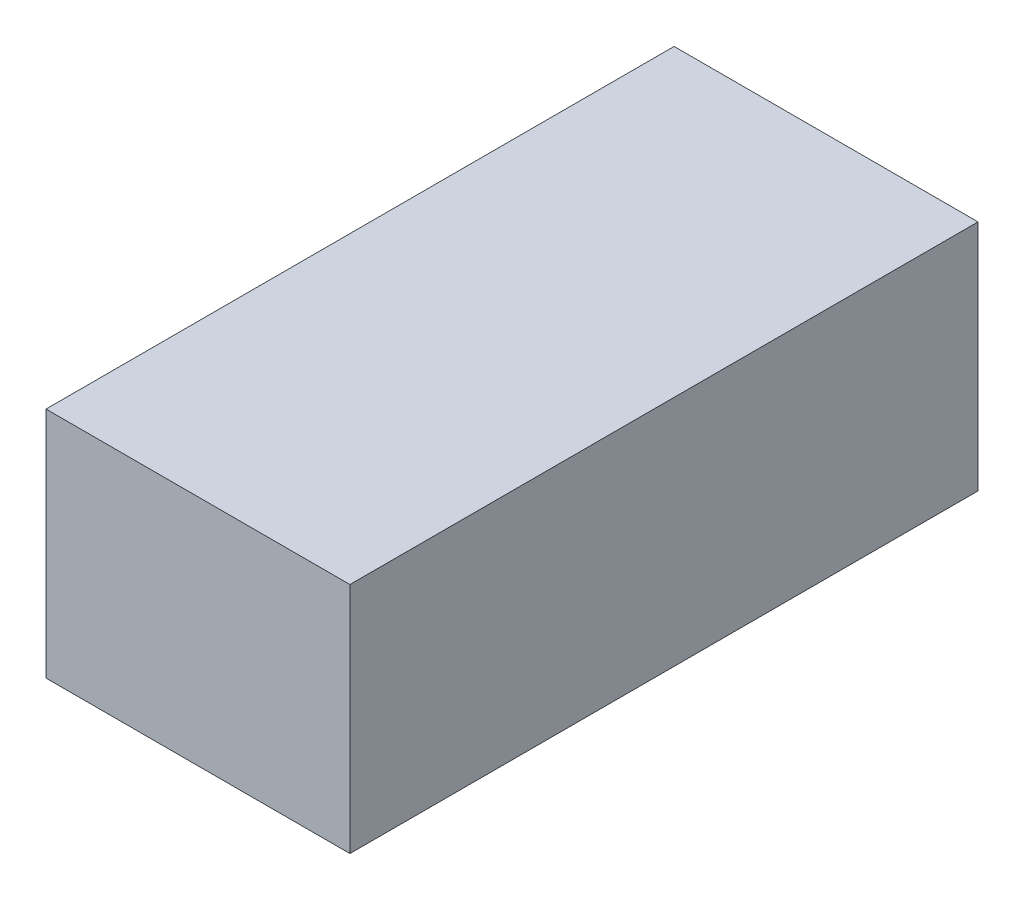
from build123d import *

# Parameters (mm, degrees)
SKETCH_1_W      = 30
SKETCH_1_H      = 23
EXTRUDE_1_DEPTH = 31


with BuildPart() as part:
    # 草图1 → 凸台-拉伸1 (new, symmetric)
    with BuildSketch(Plane.XY):
        Rectangle(SKETCH_1_W, SKETCH_1_H)
    extrude(amount=EXTRUDE_1_DEPTH, both=True)


solid = part.part
